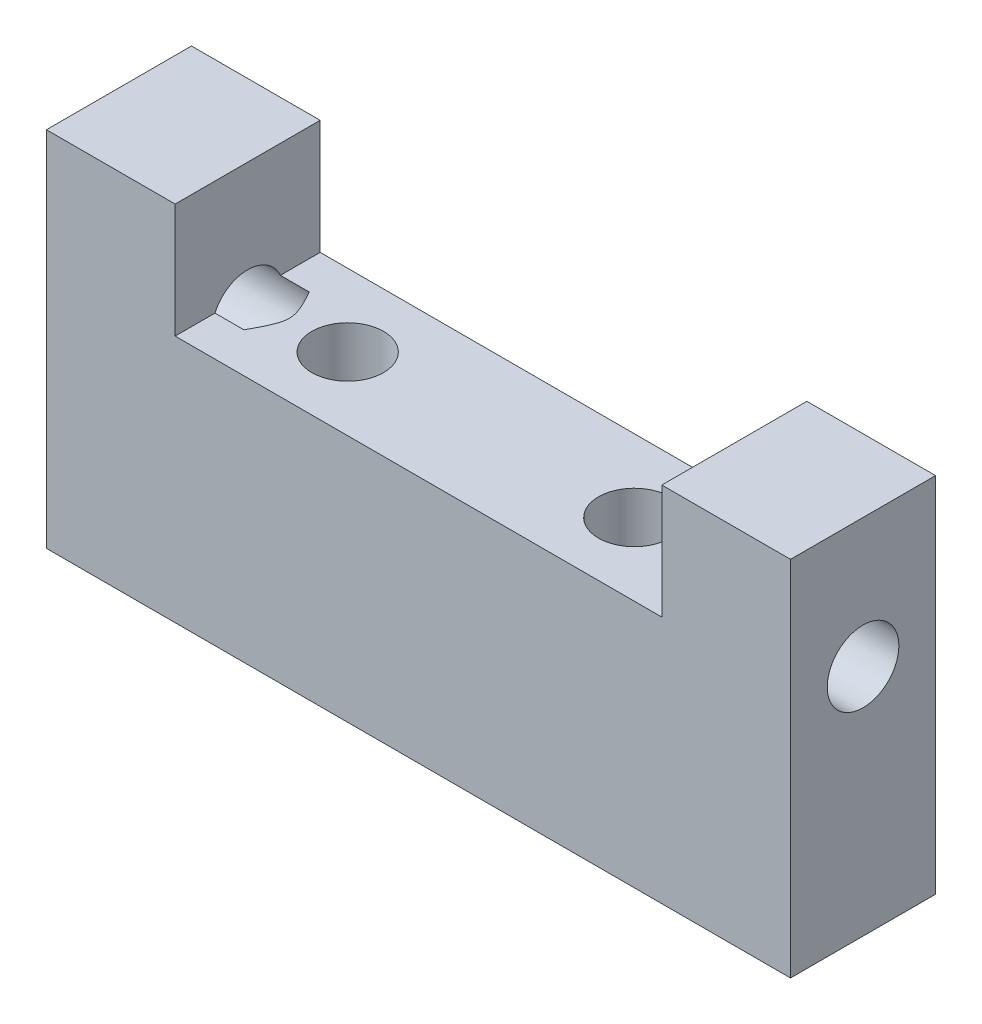
from build123d import *

# Parameters (mm, degrees)
SCHIZZO1_W                   = 25.96
SCHIZZO1_H                   = 12.65
ESTRUSIONE_ESTRUSIONE1_DEPTH = 5.06
SCHIZZO2_W                   = 8.49
SCHIZZO2_H                   = 3.99
TAGLIO_ESTRUSIONE1_DEPTH     = 16.299987745
FORO_FILETTATO_M3X0_5_1_D    = 2.5


with BuildPart() as part:
    # Schizzo1 → Estrusione-Estrusione1 (new body)
    with BuildSketch(Plane.XY):
        Rectangle(SCHIZZO1_W, SCHIZZO1_H)
    extrude(amount=-ESTRUSIONE_ESTRUSIONE1_DEPTH)

    # Schizzo2 → Taglio-Estrusione1 (cut, through all)
    with BuildSketch(Plane.XY):
        with Locations((-4.245, 4.33)):
            Rectangle(SCHIZZO2_W, SCHIZZO2_H)
        with Locations((4.245, 4.33)):
            Rectangle(SCHIZZO2_W, SCHIZZO2_H)
    extrude(amount=-TAGLIO_ESTRUSIONE1_DEPTH, mode=Mode.SUBTRACT)

    # Foro filettato M3x0.5-1 (through all)
    with Locations(Plane(origin=(0, 2.335, 0), x_dir=(1, 0, 0), z_dir=(0, 1, 0))):
        with Locations((-5, 2.53), (5, 2.53)):
            Hole(FORO_FILETTATO_M3X0_5_1_D / 2)

    # Schizzo5 → Foro filettato M3x0.5-2 (revolve, cut)
    with BuildSketch(Plane(origin=(-12.98, 1.825, -2.53), x_dir=(0, 0, 1), z_dir=(0, 1, 0))):
        Polygon((0, 0), (0, 6.251075774), (1.25, 5.5), (1.25, 0), align=None)
    foro_filettato_m3x0_5_2 = revolve(axis=Axis((-19.33, 1.825, -2.53), (1, 0, 0)), mode=Mode.SUBTRACT)

    # Specchia1: Foro filettato M3x0.5-2 across plane
    add(foro_filettato_m3x0_5_2.mirror(Plane(origin=(0, 0, 0), x_dir=(0, 0, 1), z_dir=(1, 0, 0))), mode=Mode.SUBTRACT)


solid = part.part
